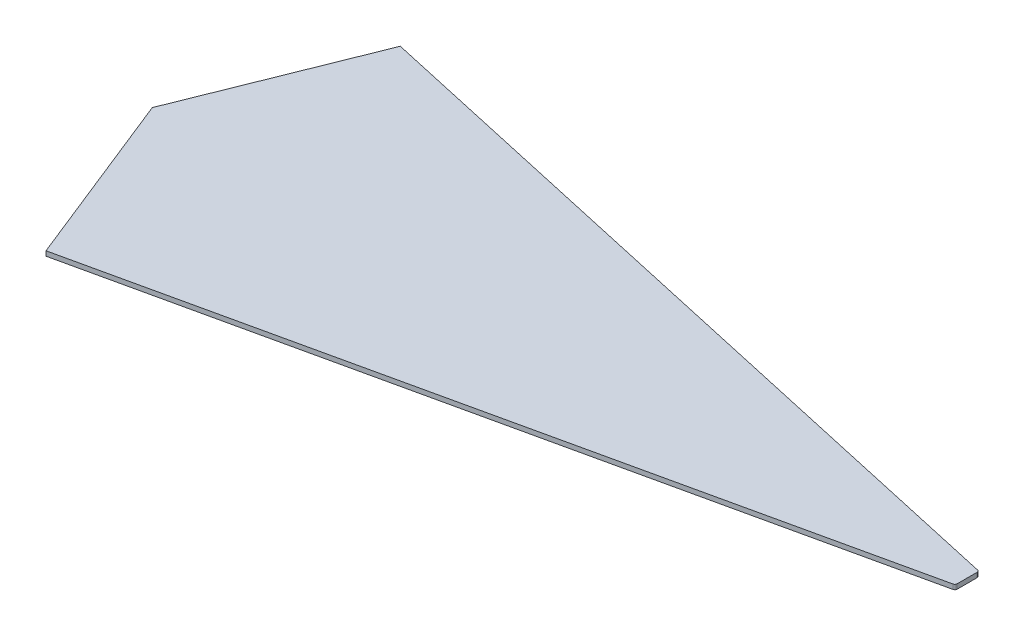
from build123d import *

# Parameters (mm, degrees)
BOSS_EXTRUDE1_DEPTH = 0.2
FILLET4_R           = 0.1
FILLET5_R           = 0.1


with BuildPart() as part:
    # Sketch2 → Boss-Extrude1 (new body)
    with BuildSketch(Plane(origin=(0, 0, 0), x_dir=(1, 0, 0), z_dir=(0, 1, 0))):
        Polygon((-3, 0), (1e-09, 7.5), (31.5, 0.5), (31.5, -0.5), (1e-09, -7.5), align=None)
    extrude(amount=BOSS_EXTRUDE1_DEPTH)

    # Fillet4
    fillet4_edges = [part.edges().sort_by_distance(p)[0] for p in [
        (31.5, 0.1, 0.5),
    ]]
    fillet(fillet4_edges, radius=FILLET4_R)

    # Fillet5
    fillet5_edges = [part.edges().sort_by_distance(p)[0] for p in [
        (31.5, 0.1, -0.5),
    ]]
    fillet(fillet5_edges, radius=FILLET5_R)


solid = part.part
